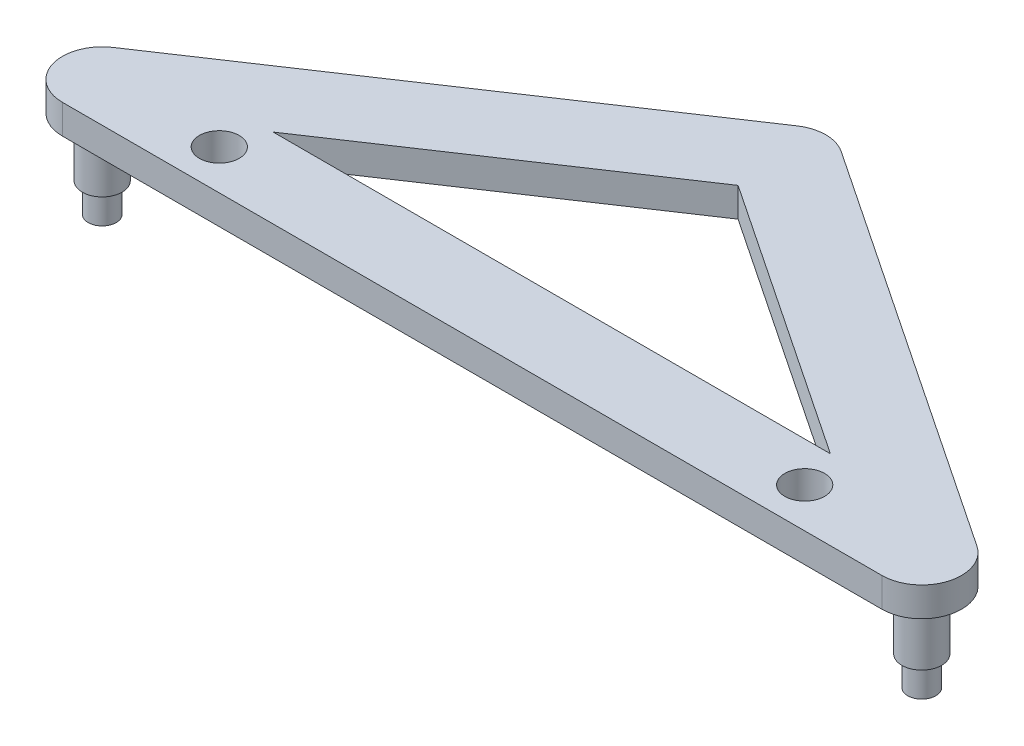
from build123d import *

# Parameters (mm, degrees)
SKETCH1_R             = 1.7
BOSS_EXTRUDE1_DEPTH   = 5
BOSS_EXTRUDE1_2_DEPTH = 5
SKETCH2_R             = 1.7
BOSS_EXTRUDE5_DEPTH   = 2.5
SKETCH3_R             = 1.2
BOSS_EXTRUDE6_DEPTH   = 2.5
SKETCH4_R             = 1.7
BOSS_EXTRUDE7_DEPTH   = 5


with BuildPart() as part:
    # Sketch1 → Boss-Extrude1 (new body)
    with BuildSketch(Plane(origin=(0, 0, 0), x_dir=(1, 0, 0), z_dir=(0, 1, 0))):
        with Locations(Location((0, 0, 0), (0, 0, 270))):
            Circle(SKETCH1_R)
    extrude(amount=BOSS_EXTRUDE1_DEPTH)



with BuildPart() as body_2:
    # Sketch1 → Boss-Extrude1 2 (new body)
    with BuildSketch(Plane(origin=(0, 0, 0), x_dir=(1, 0, 0), z_dir=(0, 1, 0))):
        with Locations(Location((70, 0, 0), (0, 0, 270))):
            Circle(SKETCH1_R)
    extrude(amount=BOSS_EXTRUDE1_2_DEPTH)


with BuildPart() as part_1:
    add(part.part)

    add(body_2.part)  # Boss-Extrude5 merges body 2
    # Sketch2 → Boss-Extrude5 (add)
    # profile 1 of 4: a face of its own
    with BuildSketch(Plane(origin=(0, 5, 0), x_dir=(1, 0, 0), z_dir=(0, 1, 0))):
        with BuildLine():
            ThreePointArc((-1.889706262, 2.826483725), (-0.987409575, 3.253463129), (0, 3.4))
            Line((0, 3.4), (11.202822944, 3.4))
            Line((11.202822944, 3.4), (35, 19.310112661))
            Line((35, 19.310112661), (35, 23.4))
            Line((35, 23.4), (35, 26.8))
            ThreePointArc((35, 26.8), (34.012590425, 26.653463129), (33.110293738, 26.226483725))
            Line((33.110293738, 26.226483725), (-1.889706262, 2.826483725))
        make_face()
    # profile 2 of 4: a face of its own
    with BuildSketch(Plane(origin=(0, 5, 0), x_dir=(1, 0, 0), z_dir=(0, 1, 0))):
        with BuildLine():
            Line((0, -3.4), (70, -3.4))
            ThreePointArc((70, -3.4), (73.4, 0), (70, 3.4))
            Line((70, 3.4), (0, 3.4))
            ThreePointArc((0, 3.4), (-3.4, 0), (0, -3.4))
        make_face()
        with Locations(Location((10, 0, 0), (0, 0, 270))):
            Circle(SKETCH2_R, mode=Mode.SUBTRACT)
        with Locations(Location((60, 0, 0), (0, 0, 270))):
            Circle(SKETCH2_R, mode=Mode.SUBTRACT)
        with Locations(Location((0, 0, 0), (0, 0, 270))):
            Circle(SKETCH2_R, mode=Mode.SUBTRACT)
    # profile 3 of 4: a face of its own
    with BuildSketch(Plane(origin=(0, 5, 0), x_dir=(1, 0, 0), z_dir=(0, 1, 0))):
        with Locations(Location((0, 0, 0), (0, 0, 270))):
            Circle(SKETCH2_R)
    # profile 4 of 4: a face of its own
    with BuildSketch(Plane(origin=(0, 5, 0), x_dir=(1, 0, 0), z_dir=(0, 1, 0))):
        with BuildLine():
            Line((35, 23.4), (35, 19.310112661))
            Line((35, 19.310112661), (58.797177056, 3.4))
            Line((58.797177056, 3.4), (70, 3.4))
            ThreePointArc((70, 3.4), (70.987409575, 3.253463129), (71.889706262, 2.826483725))
            Line((71.889706262, 2.826483725), (36.889706262, 26.226483725))
            ThreePointArc((36.889706262, 26.226483725), (35.987409575, 26.653463129), (35, 26.8))
            Line((35, 26.8), (35, 23.4))
        make_face()
    extrude(amount=BOSS_EXTRUDE5_DEPTH)

    # Sketch3 → Boss-Extrude6 (add)
    with BuildSketch(Plane.XZ):
        with Locations(Location((0, 0, 0), (0, 0, 270))):
            Circle(SKETCH3_R)
        with Locations(Location((70, 0, 0), (0, 0, 270))):
            Circle(SKETCH3_R)
    extrude(amount=BOSS_EXTRUDE6_DEPTH)

    # Sketch4 → Boss-Extrude7 (add)
    with BuildSketch(Plane.XZ.offset(-5)):
        with Locations(Location((35, -23.4, 0), (0, 0, 90))):
            Circle(SKETCH4_R)
    extrude(amount=BOSS_EXTRUDE7_DEPTH)


solid = part_1.part
